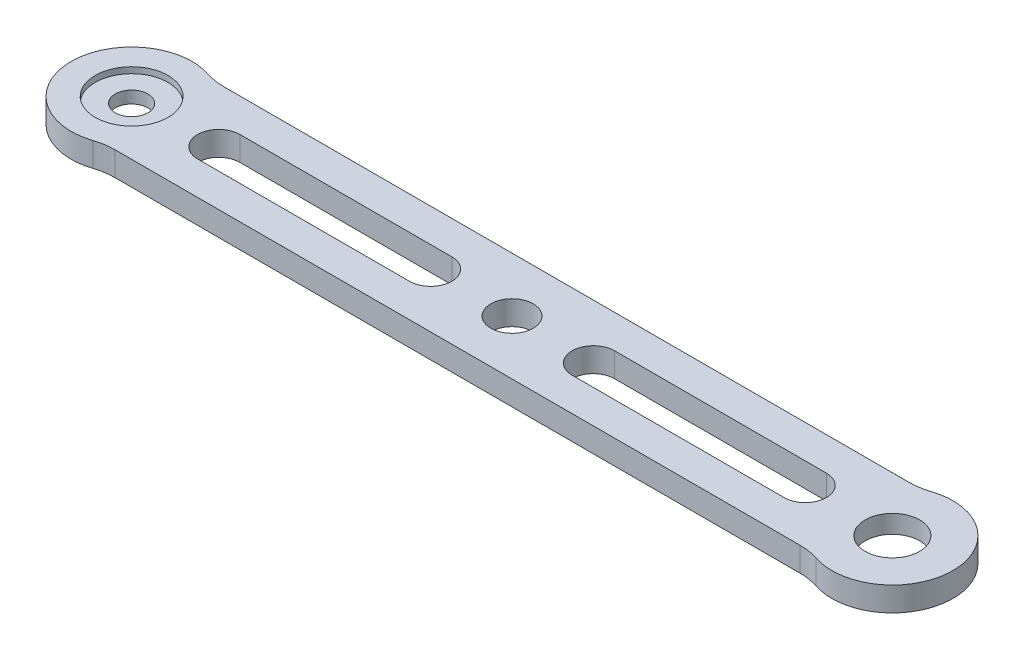
from build123d import *

# Parameters (mm, degrees)
SKETCH_1_R          = 2.7
SKETCH_1_R_2        = 2.5
SKETCH_1_R_3        = 3.5
EXTRUDE_1_DEPTH     = 4
SKETCH_2_R          = 6.01
CUT_EXTRUDE_1_DEPTH = 1
SKETCH_3_R          = 6.01
CUT_EXTRUDE_2_DEPTH = 1
CUT_EXTRUDE_START   = -1
SKETCH_4_R          = 6.01
CUT_EXTRUDE_3_DEPTH = 1
SKETCH_5_R          = 4.505
CUT_EXTRUDE_4_DEPTH = 137.097733658
FILLET_1_R          = 10


with BuildPart() as part:
    # 草图1 → 凸台-拉伸1 (new body)
    with BuildSketch(Plane(origin=(0, 0, 0), x_dir=(1, 0, 0), z_dir=(0, 1, 0))):
        with BuildLine():
            Line((4.358898944, -9), (121.312001056, -9))
            ThreePointArc((121.312001056, -9), (135.6709, 0), (121.312001056, 9))
            Line((121.312001056, 9), (4.358898944, 9))
            ThreePointArc((4.358898944, 9), (-10, 0), (4.358898944, -9))
        make_face()
        with Locations(Location((0, 0, 0), (0, 0, 270))):
            Circle(SKETCH_1_R, mode=Mode.SUBTRACT)
        with Locations(Location((125.6709, 0, 0), (0, 0, 270))):
            Circle(SKETCH_1_R_2, mode=Mode.SUBTRACT)
        with Locations(Location((62.83545, 0, 0), (0, 0, 270))):
            Circle(SKETCH_1_R_3, mode=Mode.SUBTRACT)
        with BuildLine():
            Line((49.395542126, -3.5), (14.395542126, -3.5))
            ThreePointArc((14.395542126, -3.5), (10.895542126, 0), (14.395542126, 3.5))
            Line((14.395542126, 3.5), (49.395542126, 3.5))
            ThreePointArc((49.395542126, 3.5), (52.895542126, 0), (49.395542126, -3.5))
        make_face(mode=Mode.SUBTRACT)
        with BuildLine():
            Line((76.275357874, -3.5), (111.275357874, -3.5))
            ThreePointArc((111.275357874, -3.5), (114.775357874, 0), (111.275357874, 3.5))
            Line((111.275357874, 3.5), (76.275357874, 3.5))
            ThreePointArc((76.275357874, 3.5), (72.775357874, 0), (76.275357874, -3.5))
        make_face(mode=Mode.SUBTRACT)
    extrude(amount=EXTRUDE_1_DEPTH)

    # 草图2 → 切除-拉伸1 (cut)
    with BuildSketch(Plane.XZ):
        with Locations(Location((125.6709, 0, 0), (0, 0, 270))):
            Circle(SKETCH_2_R)
    extrude(amount=-CUT_EXTRUDE_1_DEPTH, mode=Mode.SUBTRACT)

    # 草图3 → 切除-拉伸2 (cut)
    with BuildSketch(Plane(origin=(0, 4, 0), x_dir=(1, 0, 0), z_dir=(0, 1, 0))):
        with Locations(Location((0, 0, 0), (0, 0, 270))):
            Circle(SKETCH_3_R)
    extrude(amount=-CUT_EXTRUDE_2_DEPTH, mode=Mode.SUBTRACT)

    # 草图4 → 切除-拉伸3 (cut)
    with BuildSketch(Plane.XZ.offset(CUT_EXTRUDE_START)):
        with Locations(Location((0, 0, 0), (0, 0, 90))):
            Circle(SKETCH_4_R)
    extrude(amount=CUT_EXTRUDE_3_DEPTH, mode=Mode.SUBTRACT)

    # 草图5 → 切除-拉伸4 (cut, through all)
    with BuildSketch(Plane(origin=(0, 4, 0), x_dir=(1, 0, 0), z_dir=(0, 1, 0))):
        with Locations(Location((125.6709, 0, 0), (0, 0, 270))):
            Circle(SKETCH_5_R)
    extrude(amount=-CUT_EXTRUDE_4_DEPTH, mode=Mode.SUBTRACT)

    # 圆角1
    fillet_1_edges = [part.edges().sort_by_distance(p)[0] for p in [
        (4.358898944, 2, -9),
        (121.312001056, 2, -9),
        (121.312001056, 2, 9),
        (4.358898944, 2, 9),
    ]]
    fillet(fillet_1_edges, radius=FILLET_1_R)


solid = part.part
